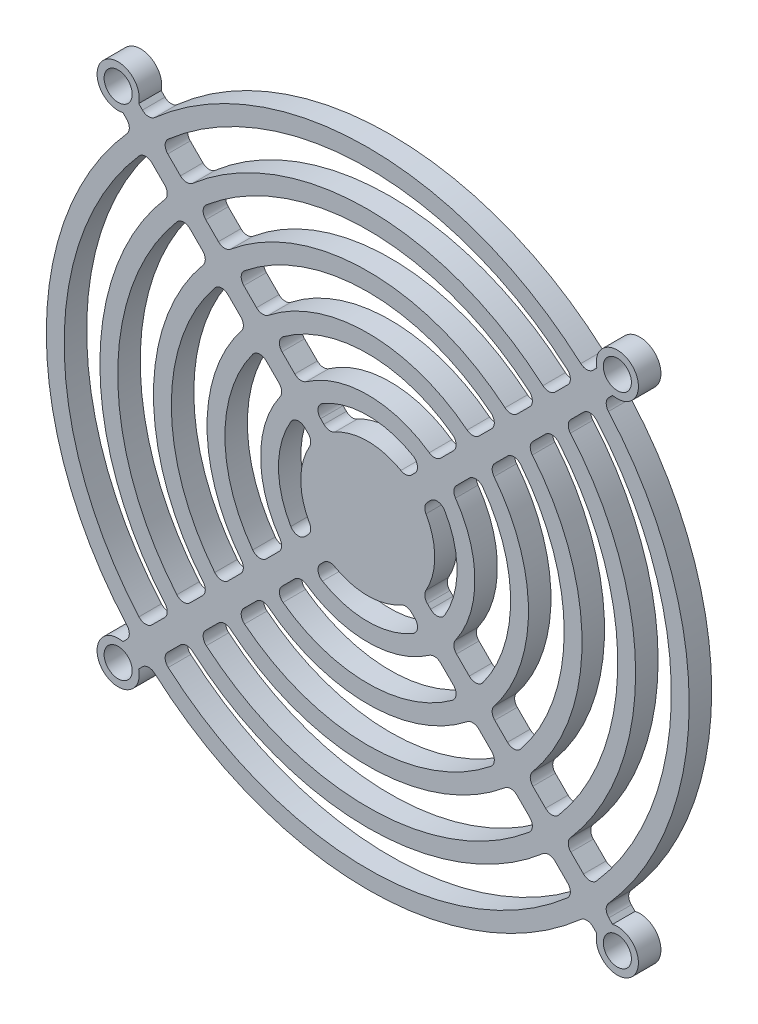
from build123d import *

# Parameters (mm, degrees)
SKETCH1_R           = 2
BOSS_EXTRUDE1_DEPTH = 3.199999696


with BuildPart() as part:
    # Sketch1 → Boss-Extrude1 (new body)
    with BuildSketch(Plane.XY):
        with BuildLine():
            Line((-32.577489686, 34.822553717), (-32.042922857, 34.287986887))
            ThreePointArc((-32.042922857, 34.287986887), (-31.183529988, 33.916600229), (-30.303143265, 34.235039189))
            ThreePointArc((-30.303143265, 34.235039189), (0, 45.72), (30.303143265, 34.235039189))
            ThreePointArc((30.303143265, 34.235039189), (31.183529988, 33.916600229), (32.042922857, 34.287986887))
            Line((32.042922857, 34.287986887), (32.577489686, 34.822553717))
            ThreePointArc((32.577489686, 34.822553717), (37.621320344, 37.621320344), (34.822553717, 32.577489686))
            Line((34.822553717, 32.577489686), (34.287986887, 32.042922857))
            ThreePointArc((34.287986887, 32.042922857), (33.916600229, 31.183529988), (34.235039189, 30.303143265))
            ThreePointArc((34.235039189, 30.303143265), (45.72, 0), (34.235039189, -30.303143265))
            ThreePointArc((34.235039189, -30.303143265), (33.916600229, -31.183529988), (34.287986887, -32.042922857))
            Line((34.287986887, -32.042922857), (34.822553717, -32.577489686))
            ThreePointArc((34.822553717, -32.577489686), (37.621320344, -37.621320344), (32.577489686, -34.822553717))
            Line((32.577489686, -34.822553717), (32.042922857, -34.287986887))
            ThreePointArc((32.042922857, -34.287986887), (31.183529988, -33.916600229), (30.303143265, -34.235039189))
            ThreePointArc((30.303143265, -34.235039189), (0, -45.72), (-30.303143265, -34.235039189))
            ThreePointArc((-30.303143265, -34.235039189), (-31.183529988, -33.916600229), (-32.042922857, -34.287986887))
            Line((-32.042922857, -34.287986887), (-32.577489686, -34.822553717))
            ThreePointArc((-32.577489686, -34.822553717), (-37.621320344, -37.621320344), (-34.822553717, -32.577489686))
            Line((-34.822553717, -32.577489686), (-34.287986887, -32.042922857))
            ThreePointArc((-34.287986887, -32.042922857), (-33.916600229, -31.183529988), (-34.235039189, -30.303143265))
            ThreePointArc((-34.235039189, -30.303143265), (-45.72, 0), (-34.235039189, 30.303143265))
            ThreePointArc((-34.235039189, 30.303143265), (-33.916600229, 31.183529988), (-34.287986887, 32.042922857))
            Line((-34.287986887, 32.042922857), (-34.822553717, 32.577489686))
            ThreePointArc((-34.822553717, 32.577489686), (-37.621320344, 37.621320344), (-32.577489686, 34.822553717))
        make_face()
        with Locations(Location((-35.5, 35.5, 0), (0, 0, 180))):
            Circle(SKETCH1_R, mode=Mode.SUBTRACT)
        with Locations(Location((35.5, 35.5, 0), (0, 0, 180))):
            Circle(SKETCH1_R, mode=Mode.SUBTRACT)
        with Locations(Location((35.5, -35.5, 0), (0, 0, 180))):
            Circle(SKETCH1_R, mode=Mode.SUBTRACT)
        with Locations(Location((-35.5, -35.5, 0), (0, 0, 180))):
            Circle(SKETCH1_R, mode=Mode.SUBTRACT)
        with BuildLine():
            Line((-8.948118055, 6.703054025), (-8.483466696, 6.238402666))
            ThreePointArc((-8.483466696, 6.238402666), (-8.122868743, 5.509984603), (-8.277787331, 4.7120974))
            ThreePointArc((-8.277787331, 4.7120974), (-9.525, 0), (-8.277787331, -4.7120974))
            ThreePointArc((-8.277787331, -4.7120974), (-8.122868743, -5.509984603), (-8.483466696, -6.238402666))
            Line((-8.483466696, -6.238402666), (-8.948118055, -6.703054025))
            ThreePointArc((-8.948118055, -6.703054025), (-10.006169119, -7.064906127), (-10.940159631, -6.45003157))
            ThreePointArc((-10.940159631, -6.45003157), (-12.7, 0), (-10.940159631, 6.45003157))
            ThreePointArc((-10.940159631, 6.45003157), (-10.006169119, 7.064906127), (-8.948118055, 6.703054025))
        make_face(mode=Mode.SUBTRACT)
        with BuildLine():
            Line((-6.703054025, 8.948118055), (-6.238402666, 8.483466696))
            ThreePointArc((-6.238402666, 8.483466696), (-5.509984603, 8.122868743), (-4.7120974, 8.277787331))
            ThreePointArc((-4.7120974, 8.277787331), (0, 9.525), (4.7120974, 8.277787331))
            ThreePointArc((4.7120974, 8.277787331), (5.509984603, 8.122868743), (6.238402666, 8.483466696))
            Line((6.238402666, 8.483466696), (6.703054025, 8.948118055))
            ThreePointArc((6.703054025, 8.948118055), (7.064906127, 10.006169119), (6.45003157, 10.940159631))
            ThreePointArc((6.45003157, 10.940159631), (0, 12.7), (-6.45003157, 10.940159631))
            ThreePointArc((-6.45003157, 10.940159631), (-7.064906127, 10.006169119), (-6.703054025, 8.948118055))
        make_face(mode=Mode.SUBTRACT)
        with BuildLine():
            Line((-14.440512225, 12.195448195), (-12.620679556, 10.375615526))
            ThreePointArc((-12.620679556, 10.375615526), (-12.253505853, 9.58791078), (-12.478804771, 8.748544536))
            ThreePointArc((-12.478804771, 8.748544536), (-15.24, 0), (-12.478804771, -8.748544536))
            ThreePointArc((-12.478804771, -8.748544536), (-12.253505853, -9.58791078), (-12.620679556, -10.375615526))
            Line((-12.620679556, -10.375615526), (-14.440512225, -12.195448195))
            ThreePointArc((-14.440512225, -12.195448195), (-15.4340584, -12.563825292), (-16.361107026, -12.050584088))
            ThreePointArc((-16.361107026, -12.050584088), (-20.32, 0), (-16.361107026, 12.050584088))
            ThreePointArc((-16.361107026, 12.050584088), (-15.4340584, 12.563825292), (-14.440512225, 12.195448195))
        make_face(mode=Mode.SUBTRACT)
        with BuildLine():
            Line((-12.195448195, 14.440512225), (-10.375615526, 12.620679556))
            ThreePointArc((-10.375615526, 12.620679556), (-9.58791078, 12.253505853), (-8.748544536, 12.478804771))
            ThreePointArc((-8.748544536, 12.478804771), (0, 15.24), (8.748544536, 12.478804771))
            ThreePointArc((8.748544536, 12.478804771), (9.58791078, 12.253505853), (10.375615526, 12.620679556))
            Line((10.375615526, 12.620679556), (12.195448195, 14.440512225))
            ThreePointArc((12.195448195, 14.440512225), (12.563825292, 15.4340584), (12.050584088, 16.361107026))
            ThreePointArc((12.050584088, 16.361107026), (0, 20.32), (-12.050584088, 16.361107026))
            ThreePointArc((-12.050584088, 16.361107026), (-12.563825292, 15.4340584), (-12.195448195, 14.440512225))
        make_face(mode=Mode.SUBTRACT)
        with BuildLine():
            Line((-19.872513265, 17.627449235), (-18.064957959, 15.819893929))
            ThreePointArc((-18.064957959, 15.819893929), (-17.695219638, 14.997198318), (-17.964931805, 14.136506827))
            ThreePointArc((-17.964931805, 14.136506827), (-22.86, 0), (-17.964931805, -14.136506827))
            ThreePointArc((-17.964931805, -14.136506827), (-17.695219638, -14.997198318), (-18.064957959, -15.819893929))
            Line((-18.064957959, -15.819893929), (-19.872513265, -17.627449235))
            ThreePointArc((-19.872513265, -17.627449235), (-20.838672713, -17.99759466), (-21.759612157, -17.526062843))
            ThreePointArc((-21.759612157, -17.526062843), (-27.94, 0), (-21.759612157, 17.526062843))
            ThreePointArc((-21.759612157, 17.526062843), (-20.838672713, 17.99759466), (-19.872513265, 17.627449235))
        make_face(mode=Mode.SUBTRACT)
        with BuildLine():
            Line((-17.627449235, 19.872513265), (-15.819893929, 18.064957959))
            ThreePointArc((-15.819893929, 18.064957959), (-14.997198318, 17.695219638), (-14.136506827, 17.964931805))
            ThreePointArc((-14.136506827, 17.964931805), (0, 22.86), (14.136506827, 17.964931805))
            ThreePointArc((14.136506827, 17.964931805), (14.997198318, 17.695219638), (15.819893929, 18.064957959))
            Line((15.819893929, 18.064957959), (17.627449235, 19.872513265))
            ThreePointArc((17.627449235, 19.872513265), (17.99759466, 20.838672713), (17.526062843, 21.759612157))
            ThreePointArc((17.526062843, 21.759612157), (0, 27.94), (-17.526062843, 21.759612157))
            ThreePointArc((-17.526062843, 21.759612157), (-17.99759466, 20.838672713), (-17.627449235, 19.872513265))
        make_face(mode=Mode.SUBTRACT)
        with BuildLine():
            Line((-25.284886968, 23.039822938), (-23.482062352, 21.236998322))
            ThreePointArc((-23.482062352, 21.236998322), (-23.111377108, 20.39618078), (-23.404884445, 19.525413801))
            ThreePointArc((-23.404884445, 19.525413801), (-30.48, 0), (-23.404884445, -19.525413801))
            ThreePointArc((-23.404884445, -19.525413801), (-23.111377108, -20.39618078), (-23.482062352, -21.236998322))
            Line((-23.482062352, -21.236998322), (-25.284886968, -23.039822938))
            ThreePointArc((-25.284886968, -23.039822938), (-26.235875322, -23.410692494), (-27.152650083, -22.961863893))
            ThreePointArc((-27.152650083, -22.961863893), (-35.56, 0), (-27.152650083, 22.961863893))
            ThreePointArc((-27.152650083, 22.961863893), (-26.235875322, 23.410692494), (-25.284886968, 23.039822938))
        make_face(mode=Mode.SUBTRACT)
        with BuildLine():
            Line((-23.039822938, 25.284886968), (-21.236998322, 23.482062352))
            ThreePointArc((-21.236998322, 23.482062352), (-20.39618078, 23.111377108), (-19.525413801, 23.404884445))
            ThreePointArc((-19.525413801, 23.404884445), (0, 30.48), (19.525413801, 23.404884445))
            ThreePointArc((19.525413801, 23.404884445), (20.39618078, 23.111377108), (21.236998322, 23.482062352))
            Line((21.236998322, 23.482062352), (23.039822938, 25.284886968))
            ThreePointArc((23.039822938, 25.284886968), (23.410692494, 26.235875322), (22.961863893, 27.152650083))
            ThreePointArc((22.961863893, 27.152650083), (0, 35.56), (-22.961863893, 27.152650083))
            ThreePointArc((-22.961863893, 27.152650083), (-23.410692494, 26.235875322), (-23.039822938, 25.284886968))
        make_face(mode=Mode.SUBTRACT)
        with BuildLine():
            Line((-28.443350297, 30.688414327), (-26.642838447, 28.887902477))
            ThreePointArc((-26.642838447, 28.887902477), (-25.790931963, 28.516765757), (-24.914335001, 28.825091699))
            ThreePointArc((-24.914335001, 28.825091699), (0, 38.1), (24.914335001, 28.825091699))
            ThreePointArc((24.914335001, 28.825091699), (25.790931963, 28.516765757), (26.642838447, 28.887902477))
            Line((26.642838447, 28.887902477), (28.443350297, 30.688414327))
            ThreePointArc((28.443350297, 30.688414327), (28.814585619, 31.629760604), (28.380031493, 32.543604786))
            ThreePointArc((28.380031493, 32.543604786), (0, 43.18), (-28.380031493, 32.543604786))
            ThreePointArc((-28.380031493, 32.543604786), (-28.814585619, 31.629760604), (-28.443350297, 30.688414327))
        make_face(mode=Mode.SUBTRACT)
        with BuildLine():
            Line((-30.688414327, 28.443350297), (-28.887902477, 26.642838447))
            ThreePointArc((-28.887902477, 26.642838447), (-28.516765757, 25.790931963), (-28.825091699, 24.914335001))
            ThreePointArc((-28.825091699, 24.914335001), (-38.1, 0), (-28.825091699, -24.914335001))
            ThreePointArc((-28.825091699, -24.914335001), (-28.516765757, -25.790931963), (-28.887902477, -26.642838447))
            Line((-28.887902477, -26.642838447), (-30.688414327, -28.443350297))
            ThreePointArc((-30.688414327, -28.443350297), (-31.629760604, -28.814585619), (-32.543604786, -28.380031493))
            ThreePointArc((-32.543604786, -28.380031493), (-43.18, 0), (-32.543604786, 28.380031493))
            ThreePointArc((-32.543604786, 28.380031493), (-31.629760604, 28.814585619), (-30.688414327, 28.443350297))
        make_face(mode=Mode.SUBTRACT)
        with BuildLine():
            Line((30.688414327, 28.443350297), (28.887902477, 26.642838447))
            ThreePointArc((28.887902477, 26.642838447), (28.516765757, 25.790931963), (28.825091699, 24.914335001))
            ThreePointArc((28.825091699, 24.914335001), (38.1, 0), (28.825091699, -24.914335001))
            ThreePointArc((28.825091699, -24.914335001), (28.516765757, -25.790931963), (28.887902477, -26.642838447))
            Line((28.887902477, -26.642838447), (30.688414327, -28.443350297))
            ThreePointArc((30.688414327, -28.443350297), (31.629760604, -28.814585619), (32.543604786, -28.380031493))
            ThreePointArc((32.543604786, -28.380031493), (43.18, 0), (32.543604786, 28.380031493))
            ThreePointArc((32.543604786, 28.380031493), (31.629760604, 28.814585619), (30.688414327, 28.443350297))
        make_face(mode=Mode.SUBTRACT)
        with BuildLine():
            Line((25.284886968, 23.039822938), (23.482062352, 21.236998322))
            ThreePointArc((23.482062352, 21.236998322), (23.111377108, 20.39618078), (23.404884445, 19.525413801))
            ThreePointArc((23.404884445, 19.525413801), (30.48, 0), (23.404884445, -19.525413801))
            ThreePointArc((23.404884445, -19.525413801), (23.111377108, -20.39618078), (23.482062352, -21.236998322))
            Line((23.482062352, -21.236998322), (25.284886968, -23.039822938))
            ThreePointArc((25.284886968, -23.039822938), (26.235875322, -23.410692494), (27.152650083, -22.961863893))
            ThreePointArc((27.152650083, -22.961863893), (35.56, 0), (27.152650083, 22.961863893))
            ThreePointArc((27.152650083, 22.961863893), (26.235875322, 23.410692494), (25.284886968, 23.039822938))
        make_face(mode=Mode.SUBTRACT)
        with BuildLine():
            Line((19.872513265, 17.627449235), (18.064957959, 15.819893929))
            ThreePointArc((18.064957959, 15.819893929), (17.695219638, 14.997198318), (17.964931805, 14.136506827))
            ThreePointArc((17.964931805, 14.136506827), (22.86, 0), (17.964931805, -14.136506827))
            ThreePointArc((17.964931805, -14.136506827), (17.695219638, -14.997198318), (18.064957959, -15.819893929))
            Line((18.064957959, -15.819893929), (19.872513265, -17.627449235))
            ThreePointArc((19.872513265, -17.627449235), (20.838672713, -17.99759466), (21.759612157, -17.526062843))
            ThreePointArc((21.759612157, -17.526062843), (27.94, 0), (21.759612157, 17.526062843))
            ThreePointArc((21.759612157, 17.526062843), (20.838672713, 17.99759466), (19.872513265, 17.627449235))
        make_face(mode=Mode.SUBTRACT)
        with BuildLine():
            Line((14.440512225, 12.195448195), (12.620679556, 10.375615526))
            ThreePointArc((12.620679556, 10.375615526), (12.253505853, 9.58791078), (12.478804771, 8.748544536))
            ThreePointArc((12.478804771, 8.748544536), (15.24, 0), (12.478804771, -8.748544536))
            ThreePointArc((12.478804771, -8.748544536), (12.253505853, -9.58791078), (12.620679556, -10.375615526))
            Line((12.620679556, -10.375615526), (14.440512225, -12.195448195))
            ThreePointArc((14.440512225, -12.195448195), (15.4340584, -12.563825292), (16.361107026, -12.050584088))
            ThreePointArc((16.361107026, -12.050584088), (20.32, 0), (16.361107026, 12.050584088))
            ThreePointArc((16.361107026, 12.050584088), (15.4340584, 12.563825292), (14.440512225, 12.195448195))
        make_face(mode=Mode.SUBTRACT)
        with BuildLine():
            Line((8.948118055, 6.703054025), (8.483466696, 6.238402666))
            ThreePointArc((8.483466696, 6.238402666), (8.122868743, 5.509984603), (8.277787331, 4.7120974))
            ThreePointArc((8.277787331, 4.7120974), (9.525, 0), (8.277787331, -4.7120974))
            ThreePointArc((8.277787331, -4.7120974), (8.122868743, -5.509984603), (8.483466696, -6.238402666))
            Line((8.483466696, -6.238402666), (8.948118055, -6.703054025))
            ThreePointArc((8.948118055, -6.703054025), (10.006169119, -7.064906127), (10.940159631, -6.45003157))
            ThreePointArc((10.940159631, -6.45003157), (12.7, 0), (10.940159631, 6.45003157))
            ThreePointArc((10.940159631, 6.45003157), (10.006169119, 7.064906127), (8.948118055, 6.703054025))
        make_face(mode=Mode.SUBTRACT)
        with BuildLine():
            Line((6.703054025, -8.948118055), (6.238402666, -8.483466696))
            ThreePointArc((6.238402666, -8.483466696), (5.509984603, -8.122868743), (4.7120974, -8.277787331))
            ThreePointArc((4.7120974, -8.277787331), (0, -9.525), (-4.7120974, -8.277787331))
            ThreePointArc((-4.7120974, -8.277787331), (-5.509984603, -8.122868743), (-6.238402666, -8.483466696))
            Line((-6.238402666, -8.483466696), (-6.703054025, -8.948118055))
            ThreePointArc((-6.703054025, -8.948118055), (-7.064906127, -10.006169119), (-6.45003157, -10.940159631))
            ThreePointArc((-6.45003157, -10.940159631), (0, -12.7), (6.45003157, -10.940159631))
            ThreePointArc((6.45003157, -10.940159631), (7.064906127, -10.006169119), (6.703054025, -8.948118055))
        make_face(mode=Mode.SUBTRACT)
        with BuildLine():
            Line((12.195448195, -14.440512225), (10.375615526, -12.620679556))
            ThreePointArc((10.375615526, -12.620679556), (9.58791078, -12.253505853), (8.748544536, -12.478804771))
            ThreePointArc((8.748544536, -12.478804771), (0, -15.24), (-8.748544536, -12.478804771))
            ThreePointArc((-8.748544536, -12.478804771), (-9.58791078, -12.253505853), (-10.375615526, -12.620679556))
            Line((-10.375615526, -12.620679556), (-12.195448195, -14.440512225))
            ThreePointArc((-12.195448195, -14.440512225), (-12.563825292, -15.4340584), (-12.050584088, -16.361107026))
            ThreePointArc((-12.050584088, -16.361107026), (0, -20.32), (12.050584088, -16.361107026))
            ThreePointArc((12.050584088, -16.361107026), (12.563825292, -15.4340584), (12.195448195, -14.440512225))
        make_face(mode=Mode.SUBTRACT)
        with BuildLine():
            Line((17.627449235, -19.872513265), (15.819893929, -18.064957959))
            ThreePointArc((15.819893929, -18.064957959), (14.997198318, -17.695219638), (14.136506827, -17.964931805))
            ThreePointArc((14.136506827, -17.964931805), (0, -22.86), (-14.136506827, -17.964931805))
            ThreePointArc((-14.136506827, -17.964931805), (-14.997198318, -17.695219638), (-15.819893929, -18.064957959))
            Line((-15.819893929, -18.064957959), (-17.627449235, -19.872513265))
            ThreePointArc((-17.627449235, -19.872513265), (-17.99759466, -20.838672713), (-17.526062843, -21.759612157))
            ThreePointArc((-17.526062843, -21.759612157), (0, -27.94), (17.526062843, -21.759612157))
            ThreePointArc((17.526062843, -21.759612157), (17.99759466, -20.838672713), (17.627449235, -19.872513265))
        make_face(mode=Mode.SUBTRACT)
        with BuildLine():
            Line((23.039822938, -25.284886968), (21.236998322, -23.482062352))
            ThreePointArc((21.236998322, -23.482062352), (20.39618078, -23.111377108), (19.525413801, -23.404884445))
            ThreePointArc((19.525413801, -23.404884445), (0, -30.48), (-19.525413801, -23.404884445))
            ThreePointArc((-19.525413801, -23.404884445), (-20.39618078, -23.111377108), (-21.236998322, -23.482062352))
            Line((-21.236998322, -23.482062352), (-23.039822938, -25.284886968))
            ThreePointArc((-23.039822938, -25.284886968), (-23.410692494, -26.235875322), (-22.961863893, -27.152650083))
            ThreePointArc((-22.961863893, -27.152650083), (0, -35.56), (22.961863893, -27.152650083))
            ThreePointArc((22.961863893, -27.152650083), (23.410692494, -26.235875322), (23.039822938, -25.284886968))
        make_face(mode=Mode.SUBTRACT)
        with BuildLine():
            Line((28.443350297, -30.688414327), (26.642838447, -28.887902477))
            ThreePointArc((26.642838447, -28.887902477), (25.790931963, -28.516765757), (24.914335001, -28.825091699))
            ThreePointArc((24.914335001, -28.825091699), (0, -38.1), (-24.914335001, -28.825091699))
            ThreePointArc((-24.914335001, -28.825091699), (-25.790931963, -28.516765757), (-26.642838447, -28.887902477))
            Line((-26.642838447, -28.887902477), (-28.443350297, -30.688414327))
            ThreePointArc((-28.443350297, -30.688414327), (-28.814585619, -31.629760604), (-28.380031493, -32.543604786))
            ThreePointArc((-28.380031493, -32.543604786), (0, -43.18), (28.380031493, -32.543604786))
            ThreePointArc((28.380031493, -32.543604786), (28.814585619, -31.629760604), (28.443350297, -30.688414327))
        make_face(mode=Mode.SUBTRACT)
    extrude(amount=BOSS_EXTRUDE1_DEPTH)


solid = part.part
